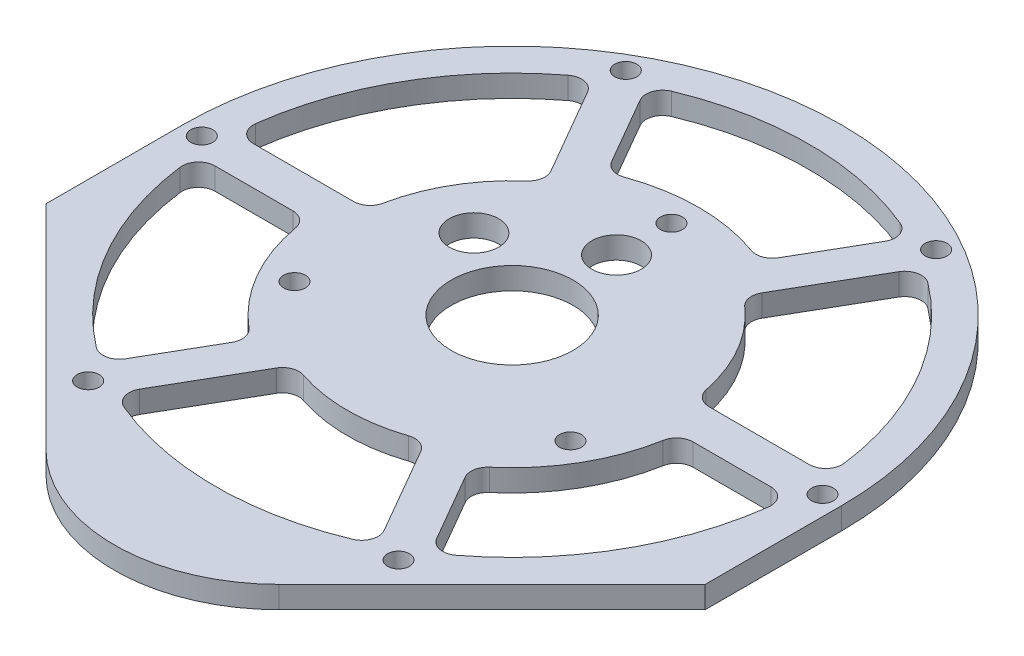
from build123d import *

# Parameters (mm, degrees)
SKETCH_1_R          = 2
SKETCH_1_R_2        = 11.1
SKETCH_1_R_3        = 4.5
EXTRUDE_1_DEPTH     = 4
CUT_EXTRUDE_1_DEPTH = 95.135988932
FILLET_2_R          = 3


with BuildPart() as part:
    # 草图1 → 凸台-拉伸1 (new body)
    with BuildSketch(Plane(origin=(0, 0, 0), x_dir=(1, 0, 0), z_dir=(0, 1, 0))):
        with BuildLine():
            Line((-60, -24.852813742), (-21.213203436, -63.639610307))
            ThreePointArc((-21.213203436, -63.639610307), (0, -72.426406871), (21.213203436, -63.639610307))
            Line((21.213203436, -63.639610307), (60, -24.852813742))
            Line((60, -24.852813742), (60, 0))
            ThreePointArc((60, 0), (0, 60), (-60, 0))
            Line((-60, 0), (-60, -24.852813742))
        make_face()
        with Locations(Location((-28.25, 48.930435314, 0), (0, 0, 270))):
            Circle(SKETCH_1_R, mode=Mode.SUBTRACT)
        with Locations(Location((28.25, 48.930435314, 0), (0, 0, 270))):
            Circle(SKETCH_1_R, mode=Mode.SUBTRACT)
        with Locations(Location((56.5, 0, 0), (0, 0, 270))):
            Circle(SKETCH_1_R, mode=Mode.SUBTRACT)
        with Locations(Location((28.25, -48.930435314, 0), (0, 0, 270))):
            Circle(SKETCH_1_R, mode=Mode.SUBTRACT)
        with Locations(Location((0, 0, 0), (0, 0, 270))):
            Circle(SKETCH_1_R_2, mode=Mode.SUBTRACT)
        with Locations(Location((-28.25, -48.930435314, 0), (0, 0, 270))):
            Circle(SKETCH_1_R, mode=Mode.SUBTRACT)
        with Locations(Location((-56.5, 0, 0), (0, 0, 270))):
            Circle(SKETCH_1_R, mode=Mode.SUBTRACT)
        with Locations(Location((0, 29, 0), (0, 0, 270))):
            Circle(SKETCH_1_R, mode=Mode.SUBTRACT)
        with Locations(Location((25.11473671, -14.5, 0), (0, 0, 270))):
            Circle(SKETCH_1_R, mode=Mode.SUBTRACT)
        with Locations(Location((-25.11473671, -14.5, 0), (0, 0, 270))):
            Circle(SKETCH_1_R, mode=Mode.SUBTRACT)
        with Locations(Location((0, 19, 0), (0, 0, 270))):
            Circle(SKETCH_1_R_3, mode=Mode.SUBTRACT)
        with Locations(Location((-16.454482672, 9.5, 0), (0, 0, 270))):
            Circle(SKETCH_1_R_3, mode=Mode.SUBTRACT)
    extrude(amount=EXTRUDE_1_DEPTH)

    # 草图2 → 切除-拉伸1 (cut, through all)
    with BuildSketch(Plane(origin=(0, 4, 0), x_dir=(1, 0, 0), z_dir=(0, 1, 0))):
        with BuildLine():
            Line((-29.974316263, 44.917038689), (-17.928655829, 24.053342807))
            ThreePointArc((-17.928655829, 24.053342807), (-25.980762114, 15), (-29.795133831, 3.5))
            Line((-29.795133831, 3.5), (-53.886454699, 3.5))
            ThreePointArc((-53.886454699, 3.5), (-46.765371804, 27), (-29.974316263, 44.917038689))
        make_face()
        with BuildLine():
            Line((23.912138436, 48.417038689), (13.87859766, 31.038436285))
            ThreePointArc((13.87859766, 31.038436285), (0, 34), (-13.87859766, 31.038436285))
            Line((-13.87859766, 31.038436285), (-23.912138436, 48.417038689))
            ThreePointArc((-23.912138436, 48.417038689), (0, 54), (23.912138436, 48.417038689))
        make_face()
        with BuildLine():
            Line((53.886454699, 3.5), (29.795133831, 3.5))
            ThreePointArc((29.795133831, 3.5), (25.980762114, 15), (17.928655829, 24.053342807))
            Line((17.928655829, 24.053342807), (29.974316263, 44.917038689))
            ThreePointArc((29.974316263, 44.917038689), (46.765371804, 27), (53.886454699, 3.5))
        make_face()
        with BuildLine():
            Line((29.974316263, -44.917038689), (19.940775486, -27.538436285))
            ThreePointArc((19.940775486, -27.538436285), (29.444863729, -17), (33.819373146, -3.5))
            Line((33.819373146, -3.5), (53.886454699, -3.5))
            ThreePointArc((53.886454699, -3.5), (46.765371804, -27), (29.974316263, -44.917038689))
        make_face()
        with BuildLine():
            Line((-23.912138436, -48.417038689), (-11.866478002, -27.553342807))
            ThreePointArc((-11.866478002, -27.553342807), (0, -30), (11.866478002, -27.553342807))
            Line((11.866478002, -27.553342807), (23.912138436, -48.417038689))
            ThreePointArc((23.912138436, -48.417038689), (0, -54), (-23.912138436, -48.417038689))
        make_face()
        with BuildLine():
            Line((-53.886454699, -3.5), (-33.819373146, -3.5))
            ThreePointArc((-33.819373146, -3.5), (-29.444863729, -17), (-19.940775486, -27.538436285))
            Line((-19.940775486, -27.538436285), (-29.974316263, -44.917038689))
            ThreePointArc((-29.974316263, -44.917038689), (-46.765371804, -27), (-53.886454699, -3.5))
        make_face()
    extrude(amount=-CUT_EXTRUDE_1_DEPTH, mode=Mode.SUBTRACT)

    # 圆角2
    fillet_2_edges = [part.edges().sort_by_distance(p)[0] for p in [
        (29.974316263, 2, -44.917038689),
        (53.886454699, 2, -3.5),
        (29.795133831, 2, -3.5),
        (17.928655829, 2, -24.053342807),
        (19.940775486, 2, 27.538436285),
        (33.819373146, 2, 3.5),
        (53.886454699, 2, 3.5),
        (29.974316263, 2, 44.917038689),
        (13.87859766, 2, -31.038436285),
        (-13.87859766, 2, -31.038436285),
        (-23.912138436, 2, -48.417038689),
        (23.912138436, 2, -48.417038689),
        (-29.974316263, 2, 44.917038689),
        (-53.886454699, 2, 3.5),
        (-33.819373146, 2, 3.5),
        (-19.940775486, 2, 27.538436285),
        (-53.886454699, 2, -3.5),
        (-29.974316263, 2, -44.917038689),
        (-17.928655829, 2, -24.053342807),
        (-29.795133831, 2, -3.5),
        (23.912138436, 2, 48.417038689),
        (-23.912138436, 2, 48.417038689),
        (-11.866478002, 2, 27.553342807),
        (11.866478002, 2, 27.553342807),
    ]]
    fillet(fillet_2_edges, radius=FILLET_2_R)


solid = part.part
